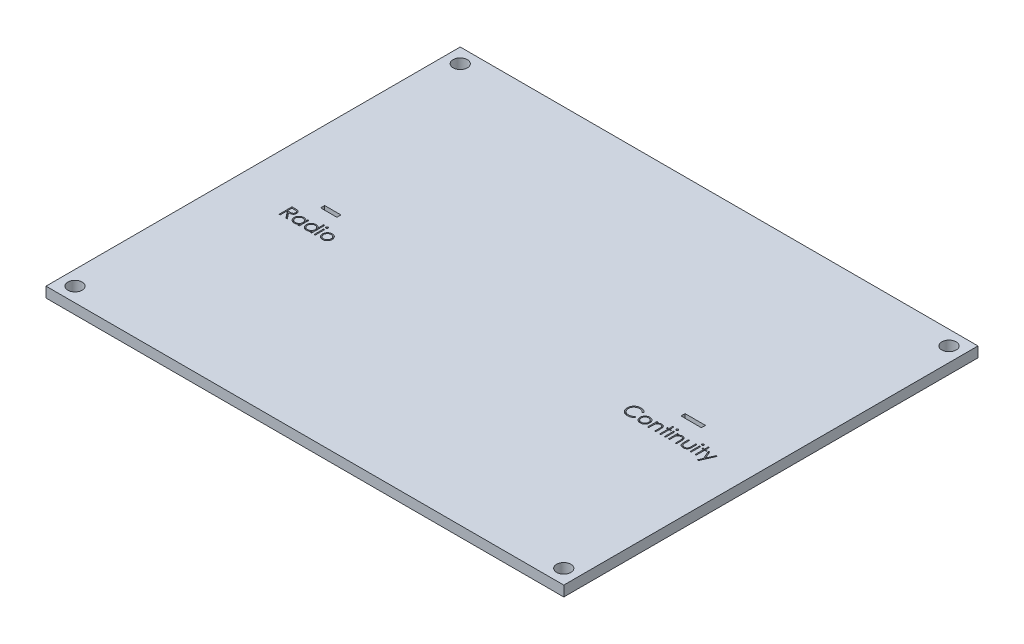
from build123d import *

# Parameters (mm, degrees)
IZIM1_W                     = 127
IZIM1_H                     = 101.6
Y_KSEKLIK_EKSTR_ZYON1_DEPTH = 2.54
IZIM3_W                     = 113.03
IZIM3_H                     = 87.63
Y_KSEKLIK_EKSTR_ZYON2_DEPTH = 1.27
IZIM4_R                     = 1.7526
KES_EKSTR_ZYON1_DEPTH       = 2.54
IZIM5_R                     = 1.7526
KES_EKSTR_ZYON2_DEPTH       = 2.54
IZIM7_R                     = 1.7526
KES_EKSTR_ZYON3_DEPTH       = 2.54
IZIM9_R                     = 1.7526
KES_EKSTR_ZYON4_DEPTH       = 2.54
IZIM10_W                    = 4
IZIM10_H                    = 1
KES_EKSTR_ZYON5_DEPTH       = 3.81
IZIM12_W                    = 0.284935898
IZIM12_H                    = 2.320192308
KES_EKSTR_ZYON9_DEPTH       = 0.762
IZIM13_W                    = 0.284935898
IZIM13_H                    = 2.320192308
IZIM13_W_2                  = 0.284935897
KES_EKSTR_ZYON10_DEPTH      = 0.762
IZIM11_W                    = 5
IZIM11_H                    = 1
KES_EKSTR_ZYON11_DEPTH      = 3.81


with BuildPart() as part:
    # Çizim1 → Yükseklik-Ekstrüzyon1 (new body)
    with BuildSketch(Plane(origin=(0, 0, 0), x_dir=(1, 0, 0), z_dir=(0, 1, 0))):
        Rectangle(IZIM1_W, IZIM1_H)
    extrude(amount=Y_KSEKLIK_EKSTR_ZYON1_DEPTH)

    # Çizim3 → Yükseklik-Ekstrüzyon2 (add)
    with BuildSketch(Plane.XZ):
        Rectangle(IZIM3_W, IZIM3_H)
    extrude(amount=Y_KSEKLIK_EKSTR_ZYON2_DEPTH)

    # Çizim4 → Kes-Ekstrüzyon1 (cut)
    with BuildSketch(Plane(origin=(0, 2.54, 0), x_dir=(1, 0, 0), z_dir=(0, 1, 0))):
        with Locations(Location((-59.944, 47.244, 0), (0, 0, 270))):
            Circle(IZIM4_R)
    extrude(amount=-KES_EKSTR_ZYON1_DEPTH, mode=Mode.SUBTRACT)

    # Çizim5 → Kes-Ekstrüzyon2 (cut)
    with BuildSketch(Plane(origin=(0, 2.54, 0), x_dir=(1, 0, 0), z_dir=(0, 1, 0))):
        with Locations(Location((59.944, 47.244, 0), (0, 0, 270))):
            Circle(IZIM5_R)
    extrude(amount=-KES_EKSTR_ZYON2_DEPTH, mode=Mode.SUBTRACT)

    # Çizim7 → Kes-Ekstrüzyon3 (cut)
    with BuildSketch(Plane(origin=(0, 2.54, 0), x_dir=(1, 0, 0), z_dir=(0, 1, 0))):
        with Locations(Location((-59.944, -47.244, 0), (0, 0, 270))):
            Circle(IZIM7_R)
    extrude(amount=-KES_EKSTR_ZYON3_DEPTH, mode=Mode.SUBTRACT)

    # Çizim9 → Kes-Ekstrüzyon4 (cut)
    with BuildSketch(Plane(origin=(0, 2.54, 0), x_dir=(1, 0, 0), z_dir=(0, 1, 0))):
        with Locations(Location((59.944, -47.244, 0), (0, 0, 270))):
            Circle(IZIM9_R)
    extrude(amount=-KES_EKSTR_ZYON4_DEPTH, mode=Mode.SUBTRACT)

    # Çizim10 → Kes-Ekstrüzyon5 (cut)
    with BuildSketch(Plane(origin=(0, 2.54, 0), x_dir=(1, 0, 0), z_dir=(0, 1, 0))):
        with Locations((-44.45, 0)):
            Rectangle(IZIM10_W, IZIM10_H)
    extrude(amount=-KES_EKSTR_ZYON5_DEPTH, mode=Mode.SUBTRACT)

    # Çizim12 → Kes-Ekstrüzyon9 (cut)
    # profile 1 of 6: a face of its own
    with BuildSketch(Plane(origin=(0, 2.54, 0), x_dir=(1, 0, 0), z_dir=(0, 1, 0))):
        with BuildLine():
            Line((-50.185607271, -3.776425051), (-49.55022566, -3.776425051))
            add(Edge.make_bspline(
                [(-49.55022566, -3.776425051), (-49.507824779, -3.776566189), (-49.426410391, -3.776837191), (-49.309776067, -3.778348276), (-49.203797201, -3.782679299), (-49.108529204, -3.786406371), (-49.023973824, -3.793202632), (-48.949871782, -3.799698362), (-48.88656437, -3.808201612), (-48.848241348, -3.816098674), (-48.830889723, -3.819674249)],
                knots=[0, 0, 0, 0, 1.410062039, 2.707475311, 3.878576406, 4.937260626, 5.877586885, 6.699081471, 7.410979367, 8, 8, 8, 8], degree=3))
            add(Edge.make_bspline(
                [(-48.830889723, -3.819674249), (-48.807660857, -3.825413529), (-48.761698659, -3.836769655), (-48.695522528, -3.860772293), (-48.632463105, -3.888548667), (-48.572782336, -3.921172899), (-48.516779154, -3.958887163), (-48.463876115, -4.001040388), (-48.413833159, -4.047401925), (-48.368674109, -4.099140674), (-48.326093683, -4.153420937), (-48.290181143, -4.212116487), (-48.259223551, -4.273495159), (-48.234576011, -4.338181173), (-48.214729563, -4.405547209), (-48.20073576, -4.476203475), (-48.192343612, -4.549828074), (-48.191489214, -4.600045605), (-48.191055989, -4.625508584)],
                knots=[0, 0, 0, 0, 1.027469482, 2.033020251, 3.019912614, 3.986113645, 4.951240523, 5.91722682, 6.890402269, 7.87763091, 8.8651537, 9.85103654, 10.82876324, 11.815024772, 12.821070561, 13.842952187, 14.906261191, 16, 16, 16, 16], degree=3))
            add(Edge.make_bspline(
                [(-48.191055989, -4.625508584), (-48.19238858, -4.667813286), (-48.19498881, -4.750360717), (-48.219232297, -4.870158803), (-48.258943854, -4.981909109), (-48.313665695, -5.085470931), (-48.383351934, -5.178825588), (-48.467103709, -5.260822644), (-48.564967742, -5.32943885), (-48.656071479, -5.377021037), (-48.736547931, -5.407494604), (-48.802799579, -5.428936158), (-48.875068909, -5.44550237), (-48.952663491, -5.460343346), (-49.035906236, -5.471548098), (-49.124597628, -5.479754651), (-49.218800923, -5.484883681), (-49.28351565, -5.4856475), (-49.316807191, -5.486040435)],
                knots=[0, 0, 0, 0, 1.260483769, 2.459530307, 3.627416485, 4.787058657, 5.939039949, 7.08810263, 8.267026773, 9.491475466, 10.141966685, 10.831826277, 11.566392101, 12.351337768, 13.187381173, 14.07005841, 15.007169909, 16, 16, 16, 16], degree=3))
            Line((-49.316807191, -5.486040435), (-48.150350861, -6.951425051))
            Line((-48.150350861, -6.951425051), (-48.502704627, -6.951425051))
            Line((-48.502704627, -6.951425051), (-49.669160957, -5.486040435))
            Line((-49.669160957, -5.486040435), (-49.900671373, -5.486040435))
            Line((-49.900671373, -5.486040435), (-49.900671373, -6.951425051))
            Line((-49.900671373, -6.951425051), (-50.185607271, -6.951425051))
            Line((-50.185607271, -6.951425051), (-50.185607271, -3.776425051))
        make_face()
        with BuildLine():
            Line((-49.900671373, -4.102066076), (-49.900671373, -5.16039941))
            Line((-49.900671373, -5.16039941), (-49.319351261, -5.164851533))
            add(Edge.make_bspline(
                [(-49.319351261, -5.164851533), (-49.292209512, -5.164863541), (-49.239601071, -5.164886815), (-49.163491182, -5.161263889), (-49.09262508, -5.15714245), (-49.027273827, -5.150838401), (-48.967408226, -5.142713965), (-48.913058201, -5.132551258), (-48.864135033, -5.120711172), (-48.807077073, -5.102385412), (-48.743362505, -5.073351381), (-48.674118967, -5.031109821), (-48.61515256, -4.977979263), (-48.565334214, -4.917224771), (-48.525302515, -4.850426174), (-48.497079437, -4.778384182), (-48.479170222, -4.702917518), (-48.477057898, -4.651048806), (-48.475991886, -4.624872567)],
                knots=[0, 0, 0, 0, 1.146690395, 2.22261258, 3.21895312, 4.145990853, 4.996080663, 5.770904154, 6.481378293, 7.121626537, 8.300444488, 9.431385265, 10.535395872, 11.636531494, 12.74115979, 13.810798291, 14.895190096, 16, 16, 16, 16], degree=3))
            add(Edge.make_bspline(
                [(-48.475991886, -4.624872567), (-48.477082382, -4.599339603), (-48.479243346, -4.548742587), (-48.496886158, -4.474669011), (-48.526721525, -4.404758278), (-48.566928126, -4.339294781), (-48.615913074, -4.27987172), (-48.673351376, -4.229028946), (-48.737672517, -4.187074074), (-48.797789961, -4.160264029), (-48.851523854, -4.143826734), (-48.898177903, -4.132259606), (-48.950893315, -4.12296641), (-49.009926052, -4.115520526), (-49.075024103, -4.109120684), (-49.146516622, -4.104810141), (-49.223929273, -4.102257565), (-49.277583989, -4.102131391), (-49.305358873, -4.102066076)],
                knots=[0, 0, 0, 0, 1.101028733, 2.181837193, 3.264309656, 4.369019818, 5.486613113, 6.575447106, 7.666700264, 8.788928104, 9.402425223, 10.0903467, 10.862060571, 11.710948788, 12.657782767, 13.684531032, 14.801375019, 16, 16, 16, 16], degree=3))
            Line((-49.305358873, -4.102066076), (-49.900671373, -4.102066076))
        make_face(mode=Mode.SUBTRACT)
    # profile 2 of 6: a face of its own
    with BuildSketch(Plane(origin=(0, 2.54, 0), x_dir=(1, 0, 0), z_dir=(0, 1, 0))):
        with BuildLine():
            Line((-45.21958163, -4.631232743), (-45.21958163, -6.951425051))
            Line((-45.21958163, -6.951425051), (-45.504517527, -6.951425051))
            Line((-45.504517527, -6.951425051), (-45.504517527, -6.550097927))
            add(Edge.make_bspline(
                [(-45.504517527, -6.550097927), (-45.53664743, -6.586419559), (-45.59934934, -6.65730168), (-45.704070925, -6.749904794), (-45.815076344, -6.826447985), (-45.931826828, -6.888269694), (-46.054216949, -6.934708203), (-46.181975399, -6.967715647), (-46.315154295, -6.988937198), (-46.406097502, -6.991056303), (-46.452183793, -6.992130179)],
                knots=[0, 0, 0, 0, 1.074387032, 2.096679803, 3.090159297, 4.057316773, 5.018401886, 5.985159533, 6.978961417, 8, 8, 8, 8], degree=3))
            add(Edge.make_bspline(
                [(-46.452183793, -6.992130179), (-46.49315758, -6.991017684), (-46.573959702, -6.988823795), (-46.692821793, -6.971803705), (-46.807205476, -6.944470927), (-46.917218839, -6.906460834), (-47.022149999, -6.856041089), (-47.122897373, -6.795678671), (-47.218939029, -6.723795918), (-47.308811068, -6.641619635), (-47.391571525, -6.552361326), (-47.464198537, -6.457160722), (-47.524753117, -6.35642949), (-47.575389904, -6.251442986), (-47.614393731, -6.141393023), (-47.641584099, -6.026660163), (-47.658584361, -5.907380064), (-47.660777344, -5.826154925), (-47.661889322, -5.784968721)],
                knots=[0, 0, 0, 0, 1.033919861, 2.038935746, 3.024066025, 3.998881131, 4.97069526, 5.957263378, 6.95902576, 7.993208707, 9.027059324, 10.027763471, 11.009749337, 11.988697705, 12.965288445, 13.950418724, 14.960734635, 16, 16, 16, 16], degree=3))
            add(Edge.make_bspline(
                [(-47.661889322, -5.784968721), (-47.660752698, -5.744633789), (-47.658505654, -5.664893807), (-47.641765947, -5.547619559), (-47.613616389, -5.434663708), (-47.57411227, -5.32638991), (-47.52345564, -5.22266715), (-47.461835161, -5.12342207), (-47.389246383, -5.02838126), (-47.305560271, -4.939779504), (-47.214905158, -4.857936518), (-47.117923667, -4.786808313), (-47.017028262, -4.725379457), (-46.910653959, -4.676708089), (-46.800375228, -4.63732983), (-46.685210317, -4.610085638), (-46.565638385, -4.594031639), (-46.484457724, -4.591706846), (-46.443279546, -4.590527615)],
                knots=[0, 0, 0, 0, 1.020392517, 2.01726096, 2.990465484, 3.961182959, 4.928053699, 5.906110375, 6.912531644, 7.948652711, 8.985773172, 9.998621852, 10.987621588, 11.969261332, 12.953316658, 13.946091881, 14.958173133, 16, 16, 16, 16], degree=3))
            add(Edge.make_bspline(
                [(-46.443279546, -4.590527615), (-46.395926817, -4.591831861), (-46.30307035, -4.594389426), (-46.167245656, -4.615673471), (-46.038753879, -4.651631224), (-45.916603146, -4.700542097), (-45.801232095, -4.76553773), (-45.693732959, -4.847525266), (-45.592980699, -4.945987628), (-45.534578577, -5.021616531), (-45.504517527, -5.060544642)],
                knots=[0, 0, 0, 0, 1.038897134, 2.037228247, 3.008116434, 3.962042015, 4.918381754, 5.904844433, 6.921570401, 8, 8, 8, 8], degree=3))
            Line((-45.504517527, -5.060544642), (-45.504517527, -4.631232743))
            Line((-45.504517527, -4.631232743), (-45.21958163, -4.631232743))
        make_face()
        with BuildLine():
            add(Edge.make_bspline(
                [(-46.439463441, -4.875463512), (-46.481114304, -4.876945455), (-46.563326484, -4.879870574), (-46.6840164, -4.902706531), (-46.799507855, -4.940701841), (-46.909223222, -4.992664709), (-47.01142939, -5.058005063), (-47.102772934, -5.137036603), (-47.184000956, -5.227603038), (-47.25231631, -5.329295666), (-47.308006261, -5.438314363), (-47.347164926, -5.552273675), (-47.3729906, -5.66911819), (-47.375629044, -5.748368627), (-47.376953425, -5.788148809)],
                knots=[0, 0, 0, 0, 1.031046209, 2.035121221, 3.029706178, 4.034933723, 5.034054252, 6.02443088, 7.017295772, 8.038157696, 9.050218397, 10.03989886, 11.016116709, 12, 12, 12, 12], degree=3))
            add(Edge.make_bspline(
                [(-47.376953425, -5.788148809), (-47.3752617, -5.827691263), (-47.371884882, -5.906621179), (-47.34761818, -6.023624988), (-47.306905724, -6.137611154), (-47.251350424, -6.247612199), (-47.1817847, -6.349742061), (-47.101149994, -6.442034886), (-47.008666524, -6.521400442), (-46.906225143, -6.587837383), (-46.796816484, -6.641506242), (-46.681759989, -6.678849357), (-46.563218517, -6.702959201), (-46.482616757, -6.705775405), (-46.442007511, -6.707194281)],
                knots=[0, 0, 0, 0, 0.979072187, 1.954306742, 2.945804271, 3.96968567, 4.997920485, 5.998718438, 6.996577872, 8.005894225, 9.015743152, 10.005417472, 10.995077863, 12, 12, 12, 12], degree=3))
            add(Edge.make_bspline(
                [(-46.442007511, -6.707194281), (-46.400781041, -6.705688457), (-46.31878568, -6.702693522), (-46.19773771, -6.679759802), (-46.080267279, -6.641869535), (-45.967974579, -6.589346756), (-45.863366374, -6.524252583), (-45.769479014, -6.448046151), (-45.690089528, -6.359415405), (-45.622786232, -6.262009623), (-45.570012819, -6.155228026), (-45.531571679, -6.04153201), (-45.508844208, -5.920917617), (-45.505979696, -5.838491055), (-45.504517527, -5.796417038)],
                knots=[0, 0, 0, 0, 1.01762866, 2.023962475, 3.030623092, 4.058876274, 5.077231937, 6.066672613, 7.034107872, 8.005628644, 8.981990164, 9.965428785, 10.961468474, 12, 12, 12, 12], degree=3))
            add(Edge.make_bspline(
                [(-45.504517527, -5.796417038), (-45.505388073, -5.764360577), (-45.507101582, -5.701263319), (-45.52019217, -5.60861907), (-45.541015567, -5.519960619), (-45.570358164, -5.435194751), (-45.608903829, -5.35479013), (-45.655392874, -5.278169433), (-45.710642818, -5.205731163), (-45.773764264, -5.138472806), (-45.842856983, -5.077125943), (-45.915967745, -5.022366954), (-45.993962751, -4.977382853), (-46.075530349, -4.940152556), (-46.160812059, -4.910526042), (-46.250501836, -4.890761491), (-46.343646346, -4.877190343), (-46.407188124, -4.876045183), (-46.439463441, -4.875463512)],
                knots=[0, 0, 0, 0, 1.050140795, 2.067009409, 3.05949893, 4.030605086, 5.00011959, 5.97591094, 6.962425594, 7.979863591, 8.993523472, 9.986985069, 10.967611495, 11.937549037, 12.921786183, 13.919465291, 14.943216303, 16, 16, 16, 16], degree=3))
        make_face(mode=Mode.SUBTRACT)
    # profile 3 of 6: a face of its own
    with BuildSketch(Plane(origin=(0, 2.54, 0), x_dir=(1, 0, 0), z_dir=(0, 1, 0))):
        with BuildLine():
            Line((-42.207402143, -3.695014794), (-42.207402143, -6.951425051))
            Line((-42.207402143, -6.951425051), (-42.49233804, -6.951425051))
            Line((-42.49233804, -6.951425051), (-42.49233804, -6.550097927))
            add(Edge.make_bspline(
                [(-42.49233804, -6.550097927), (-42.524467943, -6.586419559), (-42.587169853, -6.65730168), (-42.691891438, -6.749904794), (-42.802896857, -6.826447985), (-42.919647341, -6.888269694), (-43.042037462, -6.934708203), (-43.169795912, -6.967715647), (-43.302974808, -6.988937198), (-43.393918015, -6.991056303), (-43.440004306, -6.992130179)],
                knots=[0, 0, 0, 0, 1.074387032, 2.096679803, 3.090159297, 4.057316773, 5.018401886, 5.985159533, 6.978961417, 8, 8, 8, 8], degree=3))
            add(Edge.make_bspline(
                [(-43.440004306, -6.992130179), (-43.480978093, -6.991017684), (-43.561780214, -6.988823795), (-43.680642306, -6.971803705), (-43.795025989, -6.944470927), (-43.905039352, -6.906460834), (-44.009970512, -6.856041089), (-44.110717885, -6.795678671), (-44.206759542, -6.723795918), (-44.296631581, -6.641619635), (-44.379392038, -6.552361326), (-44.45201905, -6.457160722), (-44.512573629, -6.35642949), (-44.563210417, -6.251442986), (-44.602214244, -6.141393023), (-44.629404612, -6.026660163), (-44.646404874, -5.907380064), (-44.648597856, -5.826154925), (-44.649709835, -5.784968721)],
                knots=[0, 0, 0, 0, 1.033919861, 2.038935746, 3.024066025, 3.998881131, 4.97069526, 5.957263378, 6.95902576, 7.993208707, 9.027059324, 10.027763471, 11.009749337, 11.988697705, 12.965288445, 13.950418724, 14.960734635, 16, 16, 16, 16], degree=3))
            add(Edge.make_bspline(
                [(-44.649709835, -5.784968721), (-44.648573211, -5.744633789), (-44.646326166, -5.664893807), (-44.62958646, -5.547619559), (-44.601436902, -5.434663708), (-44.561932783, -5.32638991), (-44.511276153, -5.22266715), (-44.449655674, -5.12342207), (-44.377066896, -5.02838126), (-44.293380784, -4.939779504), (-44.202725671, -4.857936518), (-44.10574418, -4.786808313), (-44.004848774, -4.725379457), (-43.898474472, -4.676708089), (-43.788195741, -4.63732983), (-43.67303083, -4.610085638), (-43.553458898, -4.594031639), (-43.472278237, -4.591706846), (-43.431100059, -4.590527615)],
                knots=[0, 0, 0, 0, 1.020392517, 2.01726096, 2.990465484, 3.961182959, 4.928053699, 5.906110375, 6.912531644, 7.948652711, 8.985773172, 9.998621852, 10.987621588, 11.969261332, 12.953316658, 13.946091881, 14.958173133, 16, 16, 16, 16], degree=3))
            add(Edge.make_bspline(
                [(-43.431100059, -4.590527615), (-43.383731955, -4.591949195), (-43.290753631, -4.594739598), (-43.154774258, -4.618058946), (-43.02615264, -4.657213842), (-42.904148287, -4.710818076), (-42.78948855, -4.780487329), (-42.681332954, -4.864626142), (-42.581562369, -4.965615767), (-42.52253293, -5.041463409), (-42.49233804, -5.080261189)],
                knots=[0, 0, 0, 0, 1.031072012, 2.023879775, 2.993683497, 3.952812103, 4.918022106, 5.908088563, 6.929940113, 8, 8, 8, 8], degree=3))
            Line((-42.49233804, -5.080261189), (-42.49233804, -3.695014794))
            Line((-42.49233804, -3.695014794), (-42.207402143, -3.695014794))
        make_face()
        with BuildLine():
            add(Edge.make_bspline(
                [(-43.427283954, -4.875463512), (-43.468934817, -4.876945455), (-43.551146997, -4.879870574), (-43.671836913, -4.902706531), (-43.787328368, -4.940701841), (-43.897043735, -4.992664709), (-43.999249903, -5.058005063), (-44.090593447, -5.137036603), (-44.171821469, -5.227603038), (-44.240136823, -5.329295666), (-44.295826774, -5.438314363), (-44.334985438, -5.552273675), (-44.360811113, -5.66911819), (-44.363449557, -5.748368627), (-44.364773938, -5.788148809)],
                knots=[0, 0, 0, 0, 1.031046209, 2.035121221, 3.029706178, 4.034933723, 5.034054252, 6.02443088, 7.017295772, 8.038157696, 9.050218397, 10.03989886, 11.016116709, 12, 12, 12, 12], degree=3))
            add(Edge.make_bspline(
                [(-44.364773938, -5.788148809), (-44.363082213, -5.827691263), (-44.359705395, -5.906621179), (-44.335438693, -6.023624988), (-44.294726237, -6.137611154), (-44.239170937, -6.247612199), (-44.169605213, -6.349742061), (-44.088970507, -6.442034886), (-43.996487037, -6.521400442), (-43.894045656, -6.587837383), (-43.784636997, -6.641506242), (-43.669580502, -6.678849357), (-43.55103903, -6.702959201), (-43.47043727, -6.705775405), (-43.429828024, -6.707194281)],
                knots=[0, 0, 0, 0, 0.979072187, 1.954306742, 2.945804271, 3.96968567, 4.997920485, 5.998718438, 6.996577872, 8.005894225, 9.015743152, 10.005417472, 10.995077863, 12, 12, 12, 12], degree=3))
            add(Edge.make_bspline(
                [(-43.429828024, -6.707194281), (-43.388601554, -6.705688457), (-43.306606193, -6.702693522), (-43.185558222, -6.679759802), (-43.068087792, -6.641869535), (-42.955795092, -6.589346756), (-42.851186887, -6.524252583), (-42.757299527, -6.448046151), (-42.677910041, -6.359415405), (-42.610606745, -6.262009623), (-42.557833332, -6.155228026), (-42.519392192, -6.04153201), (-42.49666472, -5.920917617), (-42.493800209, -5.838491055), (-42.49233804, -5.796417038)],
                knots=[0, 0, 0, 0, 1.01762866, 2.023962475, 3.030623092, 4.058876274, 5.077231937, 6.066672613, 7.034107872, 8.005628644, 8.981990164, 9.965428785, 10.961468474, 12, 12, 12, 12], degree=3))
            add(Edge.make_bspline(
                [(-42.49233804, -5.796417038), (-42.493208586, -5.764360577), (-42.494922094, -5.701263319), (-42.508012682, -5.60861907), (-42.52883608, -5.519960619), (-42.558178677, -5.435194751), (-42.596724342, -5.35479013), (-42.643213387, -5.278169433), (-42.698463331, -5.205731163), (-42.761584776, -5.138472806), (-42.830677496, -5.077125943), (-42.903788258, -5.022366954), (-42.981783264, -4.977382853), (-43.063350862, -4.940152556), (-43.148632572, -4.910526042), (-43.238322349, -4.890761491), (-43.331466858, -4.877190343), (-43.395008637, -4.876045183), (-43.427283954, -4.875463512)],
                knots=[0, 0, 0, 0, 1.050140795, 2.067009409, 3.05949893, 4.030605086, 5.00011959, 5.97591094, 6.962425594, 7.979863591, 8.993523472, 9.986985069, 10.967611495, 11.937549037, 12.921786183, 13.919465291, 14.943216303, 16, 16, 16, 16], degree=3))
        make_face(mode=Mode.SUBTRACT)
    # profile 4 of 6: a face of its own
    with BuildSketch(Plane(origin=(0, 2.54, 0), x_dir=(1, 0, 0), z_dir=(0, 1, 0))):
        with BuildLine():
            add(Edge.make_bspline(
                [(-41.455629306, -3.654309666), (-41.437947898, -3.655129861), (-41.403324306, -3.656735962), (-41.353256127, -3.670489587), (-41.307665838, -3.693802873), (-41.267227466, -3.72508087), (-41.23252754, -3.761865008), (-41.20823361, -3.804737457), (-41.192619508, -3.851054937), (-41.190733961, -3.883362911), (-41.189773938, -3.899812471)],
                knots=[0, 0, 0, 0, 1.055194115, 2.066272739, 3.074728998, 4.095836921, 5.109056067, 6.073838105, 7.019297344, 8, 8, 8, 8], degree=3))
            add(Edge.make_bspline(
                [(-41.189773938, -3.899812471), (-41.190755611, -3.91583502), (-41.192696264, -3.947509705), (-41.208221549, -3.993024212), (-41.232734579, -4.035300954), (-41.267205215, -4.07201367), (-41.307671734, -4.103274375), (-41.353254561, -4.126592246), (-41.403324718, -4.140344656), (-41.437948037, -4.141950924), (-41.455629306, -4.142771205)],
                knots=[0, 0, 0, 0, 0.96129708, 1.900370562, 2.859976407, 3.87933698, 4.906634145, 5.921202961, 6.938410037, 8, 8, 8, 8], degree=3))
            add(Edge.make_bspline(
                [(-41.455629306, -4.142771205), (-41.473108384, -4.141982244), (-41.507129126, -4.140446636), (-41.556447619, -4.126322405), (-41.601649177, -4.103266396), (-41.642166416, -4.072218357), (-41.67593952, -4.035075486), (-41.700521572, -3.993050012), (-41.716011002, -3.947503136), (-41.717956486, -3.915832814), (-41.718940604, -3.899812471)],
                knots=[0, 0, 0, 0, 1.054934014, 2.053291228, 3.073705704, 4.106921865, 5.123545215, 6.088680038, 7.033164197, 8, 8, 8, 8], degree=3))
            add(Edge.make_bspline(
                [(-41.718940604, -3.899812471), (-41.717978047, -3.8833652), (-41.716087524, -3.851061722), (-41.700509962, -3.804711228), (-41.676144279, -3.762092295), (-41.642144053, -3.724876306), (-41.601655129, -3.693810804), (-41.556446081, -3.670759414), (-41.507129533, -3.656633985), (-41.473108522, -3.655098542), (-41.455629306, -3.654309666)],
                knots=[0, 0, 0, 0, 0.98631895, 1.937192651, 2.907499808, 3.917963147, 4.944918757, 5.95915025, 6.951458133, 8, 8, 8, 8], degree=3))
        make_face()
    # profile 5 of 6: a face of its own
    with BuildSketch(Plane(origin=(0, 2.54, 0), x_dir=(1, 0, 0), z_dir=(0, 1, 0))):
        with Locations((-41.454357271, -5.791328897)):
            Rectangle(IZIM12_W, IZIM12_H)
    # profile 6 of 6: a face of its own
    with BuildSketch(Plane(origin=(0, 2.54, 0), x_dir=(1, 0, 0), z_dir=(0, 1, 0))):
        with BuildLine():
            add(Edge.make_bspline(
                [(-39.499239082, -4.590527615), (-39.455704141, -4.591454616), (-39.370342763, -4.593272239), (-39.245331323, -4.612698672), (-39.126001093, -4.64240521), (-39.011895047, -4.683472984), (-38.904474551, -4.738520182), (-38.802174922, -4.804205753), (-38.705276635, -4.88202282), (-38.647198602, -4.942219068), (-38.617718649, -4.972774209)],
                knots=[0, 0, 0, 0, 1.054011418, 2.066658804, 3.057071809, 4.030435133, 4.997543892, 5.974964718, 6.972108034, 8, 8, 8, 8], degree=3))
            add(Edge.make_bspline(
                [(-38.617718649, -4.972774209), (-38.592335019, -5.001996896), (-38.542059003, -5.059876731), (-38.477592244, -5.153725752), (-38.422055543, -5.250917128), (-38.377548428, -5.352741489), (-38.342455585, -5.458309941), (-38.317540275, -5.567985337), (-38.302720341, -5.681525466), (-38.300721935, -5.75863609), (-38.299709835, -5.797689073)],
                knots=[0, 0, 0, 0, 1.025258237, 2.030674902, 3.01204498, 3.988269485, 4.97094183, 5.956517959, 6.965070386, 8, 8, 8, 8], degree=3))
            add(Edge.make_bspline(
                [(-38.299709835, -5.797689073), (-38.300600048, -5.836968411), (-38.302359151, -5.914586215), (-38.318999431, -6.028903783), (-38.344881202, -6.139751943), (-38.381921512, -6.246666615), (-38.429417797, -6.349974609), (-38.487375778, -6.4492247), (-38.556202174, -6.544612706), (-38.634220085, -6.63532866), (-38.720445716, -6.718936583), (-38.813986793, -6.791805799), (-38.913005095, -6.854236753), (-39.01881728, -6.904525502), (-39.130457071, -6.944176444), (-39.248165269, -6.972025745), (-39.371759011, -6.988863844), (-39.456147991, -6.991026085), (-39.499239082, -6.992130179)],
                knots=[0, 0, 0, 0, 0.998656419, 1.973391657, 2.932242238, 3.890759089, 4.846373663, 5.82037756, 6.809684879, 7.83454468, 8.860553229, 9.859544525, 10.845671541, 11.83227036, 12.833544569, 13.85385346, 14.904124723, 16, 16, 16, 16], degree=3))
            add(Edge.make_bspline(
                [(-39.499239082, -6.992130179), (-39.542541292, -6.991022379), (-39.627350857, -6.988852698), (-39.751380855, -6.972091163), (-39.869300009, -6.944189279), (-39.981085952, -6.904395196), (-40.087353064, -6.854235146), (-40.1869451, -6.791994542), (-40.280562166, -6.718914973), (-40.366806038, -6.635334515), (-40.444819058, -6.544611198), (-40.513646716, -6.449225091), (-40.571604369, -6.349974507), (-40.61910074, -6.246666642), (-40.656141027, -6.139751936), (-40.682022804, -6.028903784), (-40.698663083, -5.914586214), (-40.700422186, -5.836968411), (-40.701312399, -5.797689073)],
                knots=[0, 0, 0, 0, 1.099876186, 2.154163076, 3.173186993, 4.173200201, 5.163417411, 6.152872554, 7.150605724, 8.17532212, 9.198891216, 10.186952605, 11.159729845, 12.11414092, 13.071450619, 14.029093627, 15.002601286, 16, 16, 16, 16], degree=3))
            add(Edge.make_bspline(
                [(-40.701312399, -5.797689073), (-40.700293396, -5.758848349), (-40.698275945, -5.681950391), (-40.683470912, -5.568623701), (-40.658652793, -5.459133926), (-40.623517883, -5.353972959), (-40.578600532, -5.252594813), (-40.52384422, -5.155163288), (-40.458719861, -5.06173864), (-40.408643805, -5.003933611), (-40.383303585, -4.974682262)],
                knots=[0, 0, 0, 0, 1.031353054, 2.041901799, 3.029428768, 4.008703097, 4.981709435, 5.96992636, 6.972712378, 8, 8, 8, 8], degree=3))
            add(Edge.make_bspline(
                [(-40.383303585, -4.974682262), (-40.353868077, -4.943862139), (-40.295977972, -4.883248943), (-40.198597341, -4.805658725), (-40.096549374, -4.738606286), (-39.987941763, -4.684652862), (-39.873929456, -4.642163635), (-39.753987715, -4.612622061), (-39.628552068, -4.593342232), (-39.542772984, -4.591475171), (-39.499239082, -4.590527615)],
                knots=[0, 0, 0, 0, 1.027980169, 2.021703884, 2.998553061, 3.971491411, 4.943284454, 5.930300938, 6.949603206, 8, 8, 8, 8], degree=3))
        make_face()
        with BuildLine():
            add(Edge.make_bspline(
                [(-39.500511117, -4.875463512), (-39.531297379, -4.876338535), (-39.59207516, -4.878065991), (-39.681537212, -4.891204962), (-39.767661494, -4.912021626), (-39.850611403, -4.941598163), (-39.930107209, -4.979787878), (-40.006225024, -5.026694748), (-40.079188737, -5.081697501), (-40.147571038, -5.144710068), (-40.210329278, -5.213543156), (-40.265191443, -5.286884167), (-40.31184136, -5.363543495), (-40.350703505, -5.443600858), (-40.379647882, -5.527867548), (-40.400669124, -5.615389263), (-40.4137957, -5.70634432), (-40.415506914, -5.768176101), (-40.416376502, -5.799597126)],
                knots=[0, 0, 0, 0, 1.021534396, 2.016698045, 2.994645724, 3.958388632, 4.93408049, 5.916473867, 6.921342795, 7.962252576, 8.998418191, 10.008913653, 10.997312074, 11.973003931, 12.956656626, 13.948281152, 14.957379055, 16, 16, 16, 16], degree=3))
            add(Edge.make_bspline(
                [(-40.416376502, -5.799597126), (-40.414918883, -5.840193608), (-40.412025783, -5.920770033), (-40.388498818, -6.039434408), (-40.349141264, -6.153355088), (-40.295994232, -6.261864239), (-40.229404305, -6.362259805), (-40.15094818, -6.451768937), (-40.061467881, -6.529044638), (-39.962030056, -6.593162262), (-39.854665781, -6.644107183), (-39.741040404, -6.68021054), (-39.622530632, -6.703679861), (-39.541540254, -6.706012555), (-39.500511117, -6.707194281)],
                knots=[0, 0, 0, 0, 1.016792936, 2.018143844, 3.017858371, 4.030088057, 5.03801393, 6.028138512, 7.003788237, 7.991172063, 8.984598303, 9.972568034, 10.972917682, 12, 12, 12, 12], degree=3))
            add(Edge.make_bspline(
                [(-39.500511117, -6.707194281), (-39.459484339, -6.70600567), (-39.37849862, -6.703659384), (-39.26015351, -6.680328741), (-39.146838693, -6.643948991), (-39.039585934, -6.593219558), (-38.940193372, -6.528801153), (-38.850069526, -6.452205297), (-38.772283286, -6.362022732), (-38.70575923, -6.261731259), (-38.651741828, -6.153523311), (-38.612568495, -6.039413383), (-38.588984971, -5.920775388), (-38.586099505, -5.840195402), (-38.584645732, -5.799597126)],
                knots=[0, 0, 0, 0, 1.02726834, 2.027799167, 3.010890988, 4.004497153, 4.992059811, 5.971914811, 6.958719428, 7.966827853, 8.981595046, 9.981490638, 10.983022906, 12, 12, 12, 12], degree=3))
            add(Edge.make_bspline(
                [(-38.584645732, -5.799597126), (-38.58551502, -5.768175913), (-38.587225646, -5.706343763), (-38.600356506, -5.615391394), (-38.621361889, -5.527859731), (-38.650364713, -5.4436297), (-38.689057997, -5.363336214), (-38.736607517, -5.287109247), (-38.791245661, -5.213289094), (-38.854761192, -5.144932577), (-38.923072113, -5.081672937), (-38.996065398, -5.02667342), (-39.072070343, -4.979994029), (-39.1513352, -4.941271511), (-39.234295744, -4.91229071), (-39.320299354, -4.891084765), (-39.409379703, -4.878121516), (-39.469939692, -4.87635518), (-39.500511117, -4.875463512)],
                knots=[0, 0, 0, 0, 1.042956736, 2.052379634, 3.044323526, 4.02829302, 5.004299113, 5.996692471, 7.007513377, 8.048758398, 9.090003419, 10.095195979, 11.07790575, 12.047570684, 13.018257071, 13.989683339, 14.985167495, 16, 16, 16, 16], degree=3))
        make_face(mode=Mode.SUBTRACT)
    extrude(amount=-KES_EKSTR_ZYON9_DEPTH, mode=Mode.SUBTRACT)

    # Çizim13 → Kes-Ekstrüzyon10 (cut)
    # profile 1 of 12: a face of its own
    with BuildSketch(Plane(origin=(0, 2.54, 0), x_dir=(1, 0, 0), z_dir=(0, 1, 0))):
        with BuildLine():
            Line((36.723364142, -4.359017198), (36.474045232, -4.549822487))
            add(Edge.make_bspline(
                [(36.474045232, -4.549822487), (36.45625989, -4.528626214), (36.420928992, -4.48651944), (36.364088144, -4.427392282), (36.304850225, -4.371997367), (36.243237879, -4.320070804), (36.178142107, -4.273428452), (36.111139811, -4.229639666), (36.041110155, -4.190389647), (35.944271082, -4.142798224), (35.817590534, -4.09313564), (35.658119501, -4.051494852), (35.491648719, -4.024987071), (35.378076611, -4.022116108), (35.320309254, -4.02065582)],
                knots=[0, 0, 0, 0, 0.757959112, 1.505699292, 2.245454638, 2.979532153, 3.711538275, 4.438200793, 5.171680507, 5.909471876, 7.393775596, 8.890124382, 10.418191784, 12, 12, 12, 12], degree=3))
            add(Edge.make_bspline(
                [(35.320309254, -4.02065582), (35.28848369, -4.021022272), (35.225127932, -4.021751774), (35.13110396, -4.031375766), (35.038835692, -4.044902364), (34.948383148, -4.064973193), (34.859861464, -4.090348354), (34.772691928, -4.12066998), (34.688136598, -4.158184727), (34.605025768, -4.199648649), (34.525397483, -4.246482117), (34.45005469, -4.297566372), (34.379272176, -4.352329766), (34.312993949, -4.410977556), (34.251152253, -4.47324562), (34.194195193, -4.539797558), (34.142319856, -4.610420601), (34.094497984, -4.684183478), (34.05166929, -4.760871332), (34.015810042, -4.840768003), (33.984055396, -4.922505297), (33.958928225, -5.007006707), (33.939039557, -5.093677644), (33.925316605, -5.182750716), (33.915802063, -5.27403984), (33.915076188, -5.335915431), (33.914710296, -5.367105139)],
                knots=[0, 0, 0, 0, 1.054917814, 2.100044995, 3.131103042, 4.146048494, 5.169673617, 6.183595914, 7.203665975, 8.234915748, 9.262203917, 10.264457458, 11.251630812, 12.227803204, 13.197192746, 14.159520551, 15.12972552, 16.100847026, 17.073214652, 18.039054194, 19.002613845, 19.979014051, 20.95965708, 21.949030935, 22.966165397, 24, 24, 24, 24], degree=3))
            add(Edge.make_bspline(
                [(33.914710296, -5.367105139), (33.915854946, -5.414032836), (33.918102315, -5.506169145), (33.938103303, -5.641125342), (33.968497208, -5.770411953), (34.01404991, -5.89322081), (34.070219334, -6.011066249), (34.141194746, -6.121954352), (34.22339689, -6.227560807), (34.317988685, -6.325389767), (34.421771104, -6.414755789), (34.533120995, -6.493450959), (34.651761028, -6.559050888), (34.776381257, -6.613639068), (34.90794066, -6.655600529), (35.046202659, -6.685140841), (35.190866541, -6.704410533), (35.289717353, -6.706255379), (35.340025801, -6.707194281)],
                knots=[0, 0, 0, 0, 1.029171465, 2.020641659, 2.987623507, 3.938342917, 4.889210282, 5.84687017, 6.821220943, 7.821438502, 8.827599549, 9.822697543, 10.807740252, 11.797342354, 12.80366471, 13.83203677, 14.896651826, 16, 16, 16, 16], degree=3))
            add(Edge.make_bspline(
                [(35.340025801, -6.707194281), (35.395454669, -6.705662317), (35.50455194, -6.702647044), (35.664542936, -6.677102583), (35.817701094, -6.635684329), (35.964034655, -6.577719785), (36.103131084, -6.502367702), (36.235208054, -6.411020342), (36.360377051, -6.302808783), (36.435643857, -6.220183374), (36.474045232, -6.178027615)],
                knots=[0, 0, 0, 0, 1.028121516, 2.023589091, 2.998037872, 3.967518031, 4.937445131, 5.927275754, 6.942489185, 8, 8, 8, 8], degree=3))
            Line((36.474045232, -6.178027615), (36.723364142, -6.36692485))
            add(Edge.make_bspline(
                [(36.723364142, -6.36692485), (36.703299857, -6.392813303), (36.663267393, -6.444466205), (36.598444763, -6.517284113), (36.5301575, -6.585777059), (36.457898392, -6.64939283), (36.382498681, -6.709404381), (36.302604512, -6.764106756), (36.219266175, -6.814263487), (36.132766041, -6.86018934), (36.043196014, -6.9009357), (35.950663419, -6.935818761), (35.855567111, -6.965867768), (35.757902743, -6.990589167), (35.657467735, -7.009885079), (35.554624519, -7.022784356), (35.449151132, -7.031621664), (35.377993557, -7.03242713), (35.341933854, -7.032835307)],
                knots=[0, 0, 0, 0, 0.986787822, 1.968848986, 2.935600012, 3.899624008, 4.868462664, 5.837806735, 6.815139263, 7.798259679, 8.787526145, 9.778297419, 10.776456485, 11.791383307, 12.812564526, 13.85620153, 14.913611965, 16, 16, 16, 16], degree=3))
            add(Edge.make_bspline(
                [(35.341933854, -7.032835307), (35.30778567, -7.032597642), (35.240261865, -7.03212769), (35.140567998, -7.024514795), (35.043513164, -7.014128248), (34.949374753, -6.998488986), (34.857639047, -6.980033764), (34.76913766, -6.955294838), (34.682999719, -6.92758238), (34.599571296, -6.895011428), (34.518781425, -6.858257462), (34.440890682, -6.816717976), (34.36593489, -6.770742285), (34.293177115, -6.721343811), (34.223692164, -6.66693583), (34.156877895, -6.608273955), (34.092359648, -6.545555902), (34.052442927, -6.500330428), (34.032373557, -6.477591918)],
                knots=[0, 0, 0, 0, 1.114604814, 2.203992996, 3.262667896, 4.300477797, 5.318619304, 6.316056647, 7.298880507, 8.271930387, 9.238335007, 10.195173496, 11.151986948, 12.108099108, 13.064862484, 14.031167946, 15.010108607, 16, 16, 16, 16], degree=3))
            add(Edge.make_bspline(
                [(34.032373557, -6.477591918), (34.000228366, -6.438093839), (33.936326069, -6.359574538), (33.854569199, -6.232315112), (33.784585346, -6.099447522), (33.728001475, -5.96027373), (33.68376671, -5.815106028), (33.65312234, -5.66387124), (33.633209099, -5.506710607), (33.630931908, -5.399815806), (33.629774398, -5.345480539)],
                knots=[0, 0, 0, 0, 0.994628077, 1.977248131, 2.950237994, 3.925870899, 4.908910175, 5.911660606, 6.938484602, 8, 8, 8, 8], degree=3))
            add(Edge.make_bspline(
                [(33.629774398, -5.345480539), (33.631185181, -5.288370949), (33.633960808, -5.176011396), (33.657542708, -5.011116453), (33.695478331, -4.853136256), (33.749359794, -4.702365716), (33.817672505, -4.558011819), (33.902060934, -4.421177297), (34.001544698, -4.290987058), (34.115343563, -4.169416533), (34.240136789, -4.058255835), (34.373775999, -3.960460207), (34.515999622, -3.879073603), (34.665240816, -3.81104137), (34.822617113, -3.758749607), (34.98779274, -3.722143502), (35.160457327, -3.69935869), (35.278261099, -3.696478322), (35.338117748, -3.695014794)],
                knots=[0, 0, 0, 0, 1.032925535, 2.032216505, 3.007276963, 3.968222605, 4.92396291, 5.891752235, 6.871517503, 7.883894988, 8.900124299, 9.891468569, 10.874487609, 11.85992873, 12.854644235, 13.869047385, 14.917252991, 16, 16, 16, 16], degree=3))
            add(Edge.make_bspline(
                [(35.338117748, -3.695014794), (35.374598019, -3.695452163), (35.446807041, -3.696317889), (35.553625519, -3.704759889), (35.657622487, -3.718832946), (35.758869592, -3.737988238), (35.857859394, -3.761762023), (35.953835327, -3.79273215), (36.047360564, -3.828143861), (36.137845259, -3.868927612), (36.224855273, -3.914708156), (36.308363504, -3.964978043), (36.387706626, -4.019674953), (36.463442939, -4.07833369), (36.534305502, -4.14219524), (36.602306271, -4.20950306), (36.665135964, -4.282195886), (36.703919219, -4.333363219), (36.723364142, -4.359017198)],
                knots=[0, 0, 0, 0, 1.096760587, 2.17092713, 3.219439832, 4.250915756, 5.268269357, 6.278326846, 7.281116186, 8.274029601, 9.260640565, 10.235837813, 11.203064059, 12.156899882, 13.114053108, 14.069676657, 15.032185724, 16, 16, 16, 16], degree=3))
        make_face()
    # profile 2 of 12: a face of its own
    with BuildSketch(Plane(origin=(0, 2.54, 0), x_dir=(1, 0, 0), z_dir=(0, 1, 0))):
        with BuildLine():
            add(Edge.make_bspline(
                [(38.413898998, -4.590527615), (38.457433938, -4.591454616), (38.542795317, -4.593272239), (38.667806756, -4.612698672), (38.787136987, -4.64240521), (38.901243032, -4.683472984), (39.008663529, -4.738520182), (39.110963157, -4.804205753), (39.207861444, -4.88202282), (39.265939478, -4.942219068), (39.29541943, -4.972774209)],
                knots=[0, 0, 0, 0, 1.054011418, 2.066658804, 3.057071809, 4.030435133, 4.997543892, 5.974964718, 6.972108034, 8, 8, 8, 8], degree=3))
            add(Edge.make_bspline(
                [(39.29541943, -4.972774209), (39.32080306, -5.001996896), (39.371079077, -5.059876731), (39.435545836, -5.153725752), (39.491082537, -5.250917128), (39.535589651, -5.352741489), (39.570682494, -5.458309941), (39.595597804, -5.567985337), (39.610417738, -5.681525466), (39.612416144, -5.75863609), (39.613428245, -5.797689073)],
                knots=[0, 0, 0, 0, 1.025258237, 2.030674902, 3.01204498, 3.988269485, 4.97094183, 5.956517959, 6.965070386, 8, 8, 8, 8], degree=3))
            add(Edge.make_bspline(
                [(39.613428245, -5.797689073), (39.612538031, -5.836968411), (39.610778929, -5.914586215), (39.594138648, -6.028903783), (39.568256877, -6.139751943), (39.531216567, -6.246666615), (39.483720282, -6.349974609), (39.425762301, -6.4492247), (39.356935906, -6.544612706), (39.278917994, -6.63532866), (39.192692364, -6.718936583), (39.099151287, -6.791805799), (39.000132985, -6.854236753), (38.8943208, -6.904525502), (38.782681008, -6.944176444), (38.664972811, -6.972025745), (38.541379068, -6.988863844), (38.456990089, -6.991026085), (38.413898998, -6.992130179)],
                knots=[0, 0, 0, 0, 0.998656419, 1.973391657, 2.932242238, 3.890759089, 4.846373663, 5.82037756, 6.809684879, 7.83454468, 8.860553229, 9.859544525, 10.845671541, 11.83227036, 12.833544569, 13.85385346, 14.904124723, 16, 16, 16, 16], degree=3))
            add(Edge.make_bspline(
                [(38.413898998, -6.992130179), (38.370596788, -6.991022379), (38.285787222, -6.988852698), (38.161757224, -6.972091163), (38.04383807, -6.944189279), (37.932052127, -6.904395196), (37.825785016, -6.854235146), (37.726192979, -6.791994542), (37.632575913, -6.718914973), (37.546332042, -6.635334515), (37.468319021, -6.544611198), (37.399491364, -6.449225091), (37.341533711, -6.349974507), (37.29403734, -6.246666642), (37.256997052, -6.139751936), (37.231115276, -6.028903784), (37.214474997, -5.914586214), (37.212715894, -5.836968411), (37.21182568, -5.797689073)],
                knots=[0, 0, 0, 0, 1.099876186, 2.154163076, 3.173186993, 4.173200201, 5.163417411, 6.152872554, 7.150605724, 8.17532212, 9.198891216, 10.186952605, 11.159729845, 12.11414092, 13.071450619, 14.029093627, 15.002601286, 16, 16, 16, 16], degree=3))
            add(Edge.make_bspline(
                [(37.21182568, -5.797689073), (37.212844683, -5.758848349), (37.214862134, -5.681950391), (37.229667167, -5.568623701), (37.254485286, -5.459133926), (37.289620196, -5.353972959), (37.334537548, -5.252594813), (37.389293859, -5.155163288), (37.454418219, -5.06173864), (37.504494275, -5.003933611), (37.529834495, -4.974682262)],
                knots=[0, 0, 0, 0, 1.031353054, 2.041901799, 3.029428768, 4.008703097, 4.981709435, 5.96992636, 6.972712378, 8, 8, 8, 8], degree=3))
            add(Edge.make_bspline(
                [(37.529834495, -4.974682262), (37.559270002, -4.943862139), (37.617160107, -4.883248943), (37.714540739, -4.805658725), (37.816588705, -4.738606286), (37.925196317, -4.684652862), (38.039208624, -4.642163635), (38.159150365, -4.612622061), (38.284586011, -4.593342232), (38.370365096, -4.591475171), (38.413898998, -4.590527615)],
                knots=[0, 0, 0, 0, 1.027980169, 2.021703884, 2.998553061, 3.971491411, 4.943284454, 5.930300938, 6.949603206, 8, 8, 8, 8], degree=3))
        make_face()
        with BuildLine():
            add(Edge.make_bspline(
                [(38.412626963, -4.875463512), (38.381840701, -4.876338535), (38.32106292, -4.878065991), (38.231600868, -4.891204962), (38.145476585, -4.912021626), (38.062526677, -4.941598163), (37.98303087, -4.979787878), (37.906913055, -5.026694748), (37.833949342, -5.081697501), (37.765567042, -5.144710068), (37.702808801, -5.213543156), (37.647946637, -5.286884167), (37.601296719, -5.363543495), (37.562434575, -5.443600858), (37.533490197, -5.527867548), (37.512468955, -5.615389263), (37.49934238, -5.70634432), (37.497631165, -5.768176101), (37.496761578, -5.799597126)],
                knots=[0, 0, 0, 0, 1.021534396, 2.016698045, 2.994645724, 3.958388632, 4.93408049, 5.916473867, 6.921342795, 7.962252576, 8.998418191, 10.008913653, 10.997312074, 11.973003931, 12.956656626, 13.948281152, 14.957379055, 16, 16, 16, 16], degree=3))
            add(Edge.make_bspline(
                [(37.496761578, -5.799597126), (37.498219196, -5.840193608), (37.501112297, -5.920770033), (37.524639261, -6.039434408), (37.563996815, -6.153355088), (37.617143847, -6.261864239), (37.683733774, -6.362259805), (37.762189899, -6.451768937), (37.851670199, -6.529044638), (37.951108024, -6.593162262), (38.058472298, -6.644107183), (38.172097675, -6.68021054), (38.290607448, -6.703679861), (38.371597825, -6.706012555), (38.412626963, -6.707194281)],
                knots=[0, 0, 0, 0, 1.016792936, 2.018143844, 3.017858371, 4.030088057, 5.03801393, 6.028138512, 7.003788237, 7.991172063, 8.984598303, 9.972568034, 10.972917682, 12, 12, 12, 12], degree=3))
            add(Edge.make_bspline(
                [(38.412626963, -6.707194281), (38.45365374, -6.70600567), (38.534639459, -6.703659384), (38.65298457, -6.680328741), (38.766299387, -6.643948991), (38.873552146, -6.593219558), (38.972944707, -6.528801153), (39.063068553, -6.452205297), (39.140854793, -6.362022732), (39.207378849, -6.261731259), (39.261396251, -6.153523311), (39.300569584, -6.039413383), (39.324153109, -5.920775388), (39.327038575, -5.840195402), (39.328492347, -5.799597126)],
                knots=[0, 0, 0, 0, 1.02726834, 2.027799167, 3.010890988, 4.004497153, 4.992059811, 5.971914811, 6.958719428, 7.966827853, 8.981595046, 9.981490638, 10.983022906, 12, 12, 12, 12], degree=3))
            add(Edge.make_bspline(
                [(39.328492347, -5.799597126), (39.327623059, -5.768175913), (39.325912434, -5.706343763), (39.312781573, -5.615391394), (39.291776191, -5.527859731), (39.262773366, -5.4436297), (39.224080082, -5.363336214), (39.176530563, -5.287109247), (39.121892419, -5.213289094), (39.058376887, -5.144932577), (38.990065966, -5.081672937), (38.917072681, -5.02667342), (38.841067737, -4.979994029), (38.761802879, -4.941271511), (38.678842336, -4.91229071), (38.592838726, -4.891084765), (38.503758377, -4.878121516), (38.443198388, -4.87635518), (38.412626963, -4.875463512)],
                knots=[0, 0, 0, 0, 1.042956736, 2.052379634, 3.044323526, 4.02829302, 5.004299113, 5.996692471, 7.007513377, 8.048758398, 9.090003419, 10.095195979, 11.07790575, 12.047570684, 13.018257071, 13.989683339, 14.985167495, 16, 16, 16, 16], degree=3))
        make_face(mode=Mode.SUBTRACT)
    # profile 3 of 12: a face of its own
    with BuildSketch(Plane(origin=(0, 2.54, 0), x_dir=(1, 0, 0), z_dir=(0, 1, 0))):
        with BuildLine():
            Line((40.183300039, -4.631232743), (40.468235937, -4.631232743))
            Line((40.468235937, -4.631232743), (40.468235937, -5.049732342))
            add(Edge.make_bspline(
                [(40.468235937, -5.049732342), (40.498659363, -5.011775015), (40.557697083, -4.938117498), (40.656017157, -4.841306691), (40.759924838, -4.761527808), (40.868783798, -4.697933652), (40.982741814, -4.649994213), (41.101104245, -4.615372261), (41.224579728, -4.594612452), (41.308548896, -4.591899886), (41.351028405, -4.590527615)],
                knots=[0, 0, 0, 0, 1.12780773, 2.188550248, 3.19190651, 4.159438251, 5.104880172, 6.052711206, 7.014878035, 8, 8, 8, 8], degree=3))
            add(Edge.make_bspline(
                [(41.351028405, -4.590527615), (41.393964051, -4.592110756), (41.477999469, -4.595209346), (41.600353139, -4.619717345), (41.714629003, -4.661577683), (41.8204196, -4.718920061), (41.915785001, -4.790227362), (41.99953683, -4.873301493), (42.068809205, -4.968856368), (42.115252527, -5.057505232), (42.145846507, -5.136144352), (42.16510727, -5.203496761), (42.181463947, -5.278533941), (42.195644175, -5.36102914), (42.205239127, -5.451560355), (42.212806777, -5.549756476), (42.218230307, -5.655585694), (42.218445487, -5.728779992), (42.21855645, -5.766524209)],
                knots=[0, 0, 0, 0, 1.235846778, 2.418850247, 3.575807741, 4.728682307, 5.871620074, 6.994088408, 8.11269785, 9.256955736, 9.865816715, 10.540099792, 11.271859618, 12.076849838, 12.949306005, 13.892391288, 14.913166135, 16, 16, 16, 16], degree=3))
            Line((42.21855645, -5.766524209), (42.21855645, -6.951425051))
            Line((42.21855645, -6.951425051), (41.933620552, -6.951425051))
            Line((41.933620552, -6.951425051), (41.933620552, -5.860018801))
            add(Edge.make_bspline(
                [(41.933620552, -5.860018801), (41.933445285, -5.828429869), (41.933110029, -5.768005617), (41.93205262, -5.681492289), (41.929503724, -5.603036607), (41.925922041, -5.532826138), (41.920679634, -5.470928301), (41.915216247, -5.417217028), (41.908535161, -5.371760515), (41.902581661, -5.344396476), (41.899911618, -5.332124169)],
                knots=[0, 0, 0, 0, 1.430800155, 2.736877192, 3.918605307, 4.986035426, 5.920637409, 6.731861385, 7.431261377, 8, 8, 8, 8], degree=3))
            add(Edge.make_bspline(
                [(41.899911618, -5.332124169), (41.890272743, -5.296100452), (41.871720891, -5.22676594), (41.825879349, -5.132718492), (41.767990771, -5.052710136), (41.697326293, -4.987235538), (41.614568489, -4.936280565), (41.519947009, -4.90092562), (41.414374957, -4.878812862), (41.340121338, -4.876611106), (41.30141903, -4.875463512)],
                knots=[0, 0, 0, 0, 1.084156227, 2.086665306, 3.027808233, 3.945421172, 4.874247719, 5.839848303, 6.874090471, 8, 8, 8, 8], degree=3))
            add(Edge.make_bspline(
                [(41.30141903, -4.875463512), (41.278497631, -4.875895316), (41.233136775, -4.876749846), (41.165872158, -4.885323523), (41.100626658, -4.899346551), (41.036745468, -4.918277386), (40.975506256, -4.944278159), (40.914941506, -4.973786945), (40.857331798, -5.010569966), (40.801448717, -5.051564315), (40.749457812, -5.09699331), (40.701081391, -5.14493083), (40.657957616, -5.195980842), (40.618888175, -5.249320795), (40.585162178, -5.305683248), (40.555722591, -5.36452444), (40.530743783, -5.425921818), (40.518331626, -5.468534909), (40.512121153, -5.489856541)],
                knots=[0, 0, 0, 0, 1.023777757, 2.026029729, 3.023749952, 4.003683103, 4.997618607, 5.993177895, 7.010360494, 8.046726602, 9.087585522, 10.09234134, 11.086953743, 12.070360549, 13.043493632, 14.017870808, 15.008233677, 16, 16, 16, 16], degree=3))
            add(Edge.make_bspline(
                [(40.512121153, -5.489856541), (40.508547329, -5.505509475), (40.500767301, -5.539585094), (40.492364274, -5.595505389), (40.484737402, -5.660193723), (40.478353875, -5.733574611), (40.474448247, -5.815904969), (40.470189759, -5.906833193), (40.468639396, -6.006721858), (40.468374189, -6.076264965), (40.468235937, -6.112517799)],
                knots=[0, 0, 0, 0, 0.615963638, 1.340920617, 2.168419149, 3.115676021, 4.16674242, 5.331190069, 6.6087489, 8, 8, 8, 8], degree=3))
            Line((40.468235937, -6.112517799), (40.468235937, -6.951425051))
            Line((40.468235937, -6.951425051), (40.183300039, -6.951425051))
            Line((40.183300039, -6.951425051), (40.183300039, -4.631232743))
        make_face()
    # profile 4 of 12: a face of its own
    with BuildSketch(Plane(origin=(0, 2.54, 0), x_dir=(1, 0, 0), z_dir=(0, 1, 0))):
        Polygon((43.154774398, -3.695014794), (43.439710296, -3.695014794), (43.439710296, -4.631232743), (43.846761578, -4.631232743), (43.846761578, -4.91616864), (43.439710296, -4.91616864), (43.439710296, -6.951425051), (43.154774398, -6.951425051), (43.154774398, -4.91616864), (42.747723116, -4.91616864), (42.747723116, -4.631232743), (43.154774398, -4.631232743), align=None)
    # profile 5 of 12: a face of its own
    with BuildSketch(Plane(origin=(0, 2.54, 0), x_dir=(1, 0, 0), z_dir=(0, 1, 0))):
        with BuildLine():
            add(Edge.make_bspline(
                [(44.435713902, -3.654309666), (44.45339531, -3.655129861), (44.488018902, -3.656735962), (44.538087081, -3.670489587), (44.58367737, -3.693802873), (44.624115742, -3.72508087), (44.658815668, -3.761865008), (44.683109598, -3.804737457), (44.6987237, -3.851054937), (44.700609247, -3.883362911), (44.70156927, -3.899812471)],
                knots=[0, 0, 0, 0, 1.055194115, 2.066272739, 3.074728998, 4.095836921, 5.109056067, 6.073838105, 7.019297344, 8, 8, 8, 8], degree=3))
            add(Edge.make_bspline(
                [(44.70156927, -3.899812471), (44.700587597, -3.91583502), (44.698646944, -3.947509705), (44.683121658, -3.993024212), (44.658608628, -4.035300954), (44.624137993, -4.07201367), (44.583671474, -4.103274375), (44.538088647, -4.126592246), (44.48801849, -4.140344656), (44.45339517, -4.141950924), (44.435713902, -4.142771205)],
                knots=[0, 0, 0, 0, 0.96129708, 1.900370562, 2.859976407, 3.87933698, 4.906634145, 5.921202961, 6.938410037, 8, 8, 8, 8], degree=3))
            add(Edge.make_bspline(
                [(44.435713902, -4.142771205), (44.418234823, -4.141982244), (44.384214081, -4.140446636), (44.334895589, -4.126322405), (44.28969403, -4.103266396), (44.249176792, -4.072218357), (44.215403688, -4.035075486), (44.190821636, -3.993050012), (44.175332206, -3.947503136), (44.173386721, -3.915832814), (44.172402604, -3.899812471)],
                knots=[0, 0, 0, 0, 1.054934014, 2.053291228, 3.073705704, 4.106921865, 5.123545215, 6.088680038, 7.033164197, 8, 8, 8, 8], degree=3))
            add(Edge.make_bspline(
                [(44.172402604, -3.899812471), (44.173365161, -3.8833652), (44.175255684, -3.851061722), (44.190833246, -3.804711228), (44.215198929, -3.762092295), (44.249199154, -3.724876306), (44.289688079, -3.693810804), (44.334897126, -3.670759414), (44.384213675, -3.656633985), (44.418234686, -3.655098542), (44.435713902, -3.654309666)],
                knots=[0, 0, 0, 0, 0.98631895, 1.937192651, 2.907499808, 3.917963147, 4.944918757, 5.95915025, 6.951458133, 8, 8, 8, 8], degree=3))
        make_face()
    # profile 6 of 12: a face of its own
    with BuildSketch(Plane(origin=(0, 2.54, 0), x_dir=(1, 0, 0), z_dir=(0, 1, 0))):
        with Locations((44.436985937, -5.791328897)):
            Rectangle(IZIM13_W, IZIM13_H)
    # profile 7 of 12: a face of its own
    with BuildSketch(Plane(origin=(0, 2.54, 0), x_dir=(1, 0, 0), z_dir=(0, 1, 0))):
        with BuildLine():
            Line((45.271441065, -4.631232743), (45.556376963, -4.631232743))
            Line((45.556376963, -4.631232743), (45.556376963, -5.049732342))
            add(Edge.make_bspline(
                [(45.556376963, -5.049732342), (45.586800389, -5.011775015), (45.645838109, -4.938117498), (45.744158182, -4.841306691), (45.848065863, -4.761527808), (45.956924824, -4.697933652), (46.07088284, -4.649994213), (46.189245271, -4.615372261), (46.312720754, -4.594612452), (46.396689922, -4.591899886), (46.43916943, -4.590527615)],
                knots=[0, 0, 0, 0, 1.12780773, 2.188550248, 3.19190651, 4.159438251, 5.104880172, 6.052711206, 7.014878035, 8, 8, 8, 8], degree=3))
            add(Edge.make_bspline(
                [(46.43916943, -4.590527615), (46.482105077, -4.592110756), (46.566140494, -4.595209346), (46.688494164, -4.619717345), (46.802770029, -4.661577683), (46.908560626, -4.718920061), (47.003926026, -4.790227362), (47.087677856, -4.873301493), (47.15695023, -4.968856368), (47.203393552, -5.057505232), (47.233987533, -5.136144352), (47.253248296, -5.203496761), (47.269604972, -5.278533941), (47.283785201, -5.36102914), (47.293380152, -5.451560355), (47.300947802, -5.549756476), (47.306371332, -5.655585694), (47.306586513, -5.728779992), (47.306697475, -5.766524209)],
                knots=[0, 0, 0, 0, 1.235846778, 2.418850247, 3.575807741, 4.728682307, 5.871620074, 6.994088408, 8.11269785, 9.256955736, 9.865816715, 10.540099792, 11.271859618, 12.076849838, 12.949306005, 13.892391288, 14.913166135, 16, 16, 16, 16], degree=3))
            Line((47.306697475, -5.766524209), (47.306697475, -6.951425051))
            Line((47.306697475, -6.951425051), (47.021761578, -6.951425051))
            Line((47.021761578, -6.951425051), (47.021761578, -5.860018801))
            add(Edge.make_bspline(
                [(47.021761578, -5.860018801), (47.021586311, -5.828429869), (47.021251054, -5.768005617), (47.020193646, -5.681492289), (47.01764475, -5.603036607), (47.014063066, -5.532826138), (47.00882066, -5.470928301), (47.003357273, -5.417217028), (46.996676187, -5.371760515), (46.990722687, -5.344396476), (46.988052644, -5.332124169)],
                knots=[0, 0, 0, 0, 1.430800155, 2.736877192, 3.918605307, 4.986035426, 5.920637409, 6.731861385, 7.431261377, 8, 8, 8, 8], degree=3))
            add(Edge.make_bspline(
                [(46.988052644, -5.332124169), (46.978413769, -5.296100452), (46.959861916, -5.22676594), (46.914020375, -5.132718492), (46.856131796, -5.052710136), (46.785467319, -4.987235538), (46.702709514, -4.936280565), (46.608088035, -4.90092562), (46.502515982, -4.878812862), (46.428262364, -4.876611106), (46.389560055, -4.875463512)],
                knots=[0, 0, 0, 0, 1.084156227, 2.086665306, 3.027808233, 3.945421172, 4.874247719, 5.839848303, 6.874090471, 8, 8, 8, 8], degree=3))
            add(Edge.make_bspline(
                [(46.389560055, -4.875463512), (46.366638657, -4.875895316), (46.321277801, -4.876749846), (46.254013184, -4.885323523), (46.188767684, -4.899346551), (46.124886494, -4.918277386), (46.063647281, -4.944278159), (46.003082531, -4.973786945), (45.945472824, -5.010569966), (45.889589742, -5.051564315), (45.837598838, -5.09699331), (45.789222417, -5.14493083), (45.746098641, -5.195980842), (45.7070292, -5.249320795), (45.673303204, -5.305683248), (45.643863617, -5.36452444), (45.618884808, -5.425921818), (45.606472651, -5.468534909), (45.600262179, -5.489856541)],
                knots=[0, 0, 0, 0, 1.023777757, 2.026029729, 3.023749952, 4.003683103, 4.997618607, 5.993177895, 7.010360494, 8.046726602, 9.087585522, 10.09234134, 11.086953743, 12.070360549, 13.043493632, 14.017870808, 15.008233677, 16, 16, 16, 16], degree=3))
            add(Edge.make_bspline(
                [(45.600262179, -5.489856541), (45.596688355, -5.505509475), (45.588908327, -5.539585094), (45.580505299, -5.595505389), (45.572878427, -5.660193723), (45.566494901, -5.733574611), (45.562589273, -5.815904969), (45.558330784, -5.906833193), (45.556780422, -6.006721858), (45.556515215, -6.076264965), (45.556376963, -6.112517799)],
                knots=[0, 0, 0, 0, 0.615963638, 1.340920617, 2.168419149, 3.115676021, 4.16674242, 5.331190069, 6.6087489, 8, 8, 8, 8], degree=3))
            Line((45.556376963, -6.112517799), (45.556376963, -6.951425051))
            Line((45.556376963, -6.951425051), (45.271441065, -6.951425051))
            Line((45.271441065, -6.951425051), (45.271441065, -4.631232743))
        make_face()
    # profile 8 of 12: a face of its own
    with BuildSketch(Plane(origin=(0, 2.54, 0), x_dir=(1, 0, 0), z_dir=(0, 1, 0))):
        with BuildLine():
            Line((47.917274398, -4.631232743), (48.202210296, -4.631232743))
            Line((48.202210296, -4.631232743), (48.202210296, -5.70737457))
            add(Edge.make_bspline(
                [(48.202210296, -5.70737457), (48.202339024, -5.738963778), (48.202585275, -5.799392454), (48.204255271, -5.886346802), (48.208183284, -5.965646248), (48.213094397, -6.037336602), (48.219410049, -6.101405736), (48.22692424, -6.157629867), (48.235322951, -6.206646591), (48.243544127, -6.236168064), (48.247367547, -6.249897607)],
                knots=[0, 0, 0, 0, 1.388932606, 2.656963016, 3.823490214, 4.879454478, 5.816252168, 6.653371382, 7.373723809, 8, 8, 8, 8], degree=3))
            add(Edge.make_bspline(
                [(48.247367547, -6.249897607), (48.253501153, -6.267154068), (48.265640848, -6.301308234), (48.287660366, -6.350646831), (48.314900357, -6.396344409), (48.344708915, -6.440163103), (48.379089092, -6.480804906), (48.417605898, -6.518201184), (48.458970013, -6.553764895), (48.520433498, -6.595842528), (48.604488689, -6.640941435), (48.714845117, -6.67985407), (48.834501094, -6.703109421), (48.917200518, -6.705807495), (48.959707291, -6.707194281)],
                knots=[0, 0, 0, 0, 0.725840625, 1.436591201, 2.137033971, 2.831655856, 3.53531722, 4.242432219, 4.957935707, 5.694543706, 7.190802206, 8.724350549, 10.316345118, 12, 12, 12, 12], degree=3))
            add(Edge.make_bspline(
                [(48.959707291, -6.707194281), (49.002210116, -6.705778006), (49.084445218, -6.703037775), (49.202786511, -6.680555565), (49.31096458, -6.64299469), (49.407893657, -6.590555109), (49.493134098, -6.526381952), (49.564167392, -6.451081104), (49.622775402, -6.367034875), (49.648365376, -6.304329279), (49.661234735, -6.272794241)],
                knots=[0, 0, 0, 0, 1.157059328, 2.238695713, 3.266970494, 4.264342957, 5.228770407, 6.160125903, 7.074715775, 8, 8, 8, 8], degree=3))
            add(Edge.make_bspline(
                [(49.661234735, -6.272794241), (49.665039501, -6.260124813), (49.673450909, -6.232115802), (49.682488185, -6.184599887), (49.690629304, -6.127935568), (49.697580899, -6.06175205), (49.702538582, -5.98622229), (49.705211049, -5.901369892), (49.70823027, -5.80746123), (49.708276096, -5.74172262), (49.708300039, -5.70737457)],
                knots=[0, 0, 0, 0, 0.557542046, 1.232589297, 2.036731608, 2.971723315, 4.038036528, 5.22795436, 6.551621927, 8, 8, 8, 8], degree=3))
            Line((49.708300039, -5.70737457), (49.708300039, -4.631232743))
            Line((49.708300039, -4.631232743), (49.993235937, -4.631232743))
            Line((49.993235937, -4.631232743), (49.993235937, -5.760800051))
            add(Edge.make_bspline(
                [(49.993235937, -5.760800051), (49.992835257, -5.799178699), (49.992057882, -5.873638527), (49.987061935, -5.981846257), (49.978489786, -6.082686293), (49.965478922, -6.176212014), (49.950179346, -6.262352015), (49.930443298, -6.341216698), (49.906877325, -6.412563079), (49.880293037, -6.47764312), (49.848886057, -6.536649945), (49.815478688, -6.59265315), (49.776902645, -6.64426317), (49.736289647, -6.694049109), (49.69111243, -6.739534637), (49.642217558, -6.781763476), (49.590293228, -6.821381155), (49.534187169, -6.85684253), (49.474718455, -6.888789058), (49.411813671, -6.9171065), (49.344702336, -6.939515267), (49.274250323, -6.958847085), (49.200112459, -6.974009496), (49.122360217, -6.984701596), (49.041019786, -6.991256003), (48.985584776, -6.991833894), (48.957163221, -6.992130179)],
                knots=[0, 0, 0, 0, 1.493040784, 2.896703357, 4.213163133, 5.428574705, 6.569057535, 7.615249723, 8.588095153, 9.490268104, 10.346124644, 11.18633936, 12.024365274, 12.850166724, 13.684164916, 14.514361689, 15.362232829, 16.222528818, 17.093394965, 17.986930858, 18.902426812, 19.842810585, 20.827885679, 21.843828298, 22.894529745, 24, 24, 24, 24], degree=3))
            add(Edge.make_bspline(
                [(48.957163221, -6.992130179), (48.92895424, -6.991822016), (48.873520967, -6.991216447), (48.792176338, -6.984737807), (48.714208674, -6.97402611), (48.639895169, -6.95873602), (48.569161252, -6.939650578), (48.501720406, -6.916968799), (48.438362316, -6.888774362), (48.378325784, -6.857044721), (48.322080761, -6.821153364), (48.269367979, -6.781812356), (48.22025812, -6.739080428), (48.174740351, -6.693136039), (48.13345358, -6.643409247), (48.095883313, -6.59030006), (48.061451159, -6.534334708), (48.030288271, -6.474405982), (48.003516893, -6.408572802), (47.979881062, -6.335731864), (47.960549269, -6.255084581), (47.944817173, -6.166699903), (47.932161223, -6.07100083), (47.923374508, -5.967433767), (47.918461576, -5.856250989), (47.917678656, -5.779461446), (47.917274398, -5.739811469)],
                knots=[0, 0, 0, 0, 1.083640291, 2.129454052, 3.13281866, 4.105697902, 5.042300162, 5.946461698, 6.836384745, 7.703652036, 8.553297018, 9.397182691, 10.228592656, 11.052265423, 11.879314572, 12.708807002, 13.549817954, 14.402308542, 15.300838682, 16.27712199, 17.341985831, 18.484375296, 19.725102775, 21.0496083, 22.476576903, 24, 24, 24, 24], degree=3))
            Line((47.917274398, -5.739811469), (47.917274398, -4.631232743))
        make_face()
    # profile 9 of 12: a face of its own
    with BuildSketch(Plane(origin=(0, 2.54, 0), x_dir=(1, 0, 0), z_dir=(0, 1, 0))):
        with BuildLine():
            add(Edge.make_bspline(
                [(50.745008773, -3.654309666), (50.762690181, -3.655129861), (50.797313774, -3.656735962), (50.847381952, -3.670489587), (50.892972242, -3.693802873), (50.933410614, -3.72508087), (50.96811054, -3.761865008), (50.99240447, -3.804737457), (51.008018572, -3.851054937), (51.009904119, -3.883362911), (51.010864142, -3.899812471)],
                knots=[0, 0, 0, 0, 1.055194115, 2.066272739, 3.074728998, 4.095836921, 5.109056067, 6.073838105, 7.019297344, 8, 8, 8, 8], degree=3))
            add(Edge.make_bspline(
                [(51.010864142, -3.899812471), (51.009882468, -3.91583502), (51.007941816, -3.947509705), (50.99241653, -3.993024212), (50.9679035, -4.035300954), (50.933432865, -4.07201367), (50.892966346, -4.103274375), (50.847383519, -4.126592246), (50.797313362, -4.140344656), (50.762690042, -4.141950924), (50.745008773, -4.142771205)],
                knots=[0, 0, 0, 0, 0.96129708, 1.900370562, 2.859976407, 3.87933698, 4.906634145, 5.921202961, 6.938410037, 8, 8, 8, 8], degree=3))
            add(Edge.make_bspline(
                [(50.745008773, -4.142771205), (50.727529695, -4.141982244), (50.693508953, -4.140446636), (50.644190461, -4.126322405), (50.598988902, -4.103266396), (50.558471664, -4.072218357), (50.52469856, -4.035075486), (50.500116507, -3.993050012), (50.484627078, -3.947503136), (50.482681593, -3.915832814), (50.481697475, -3.899812471)],
                knots=[0, 0, 0, 0, 1.054934014, 2.053291228, 3.073705704, 4.106921865, 5.123545215, 6.088680038, 7.033164197, 8, 8, 8, 8], degree=3))
            add(Edge.make_bspline(
                [(50.481697475, -3.899812471), (50.482660032, -3.8833652), (50.484550555, -3.851061722), (50.500128118, -3.804711228), (50.524493801, -3.762092295), (50.558494026, -3.724876306), (50.598982951, -3.693810804), (50.644191998, -3.670759414), (50.693508547, -3.656633985), (50.727529557, -3.655098542), (50.745008773, -3.654309666)],
                knots=[0, 0, 0, 0, 0.98631895, 1.937192651, 2.907499808, 3.917963147, 4.944918757, 5.95915025, 6.951458133, 8, 8, 8, 8], degree=3))
        make_face()
    # profile 10 of 12: a face of its own
    with BuildSketch(Plane(origin=(0, 2.54, 0), x_dir=(1, 0, 0), z_dir=(0, 1, 0))):
        with Locations((50.746280809, -5.791328897)):
            Rectangle(IZIM13_W_2, IZIM13_H)
    # profile 11 of 12: a face of its own
    with BuildSketch(Plane(origin=(0, 2.54, 0), x_dir=(1, 0, 0), z_dir=(0, 1, 0))):
        Polygon((51.865671834, -3.695014794), (52.150607732, -3.695014794), (52.150607732, -4.631232743), (52.557659014, -4.631232743), (52.557659014, -4.91616864), (52.150607732, -4.91616864), (52.150607732, -6.951425051), (51.865671834, -6.951425051), (51.865671834, -4.91616864), (51.458620552, -4.91616864), (51.458620552, -4.631232743), (51.865671834, -4.631232743), align=None)
    # profile 12 of 12: a face of its own
    with BuildSketch(Plane(origin=(0, 2.54, 0), x_dir=(1, 0, 0), z_dir=(0, 1, 0))):
        Polygon((52.801889783, -4.631232743), (53.109086297, -4.631232743), (53.894568068, -6.408265996), (54.692134174, -4.631232743), (54.999966706, -4.631232743), (53.575287219, -7.806232743), (53.267454687, -7.806232743), (53.740015785, -6.753623568), align=None)
    extrude(amount=-KES_EKSTR_ZYON10_DEPTH, mode=Mode.SUBTRACT)

    # Çizim11 → Kes-Ekstrüzyon11 (cut)
    with BuildSketch(Plane(origin=(0, 2.54, 0), x_dir=(1, 0, 0), z_dir=(0, 1, 0))):
        with Locations((44.45, 0)):
            Rectangle(IZIM11_W, IZIM11_H)
    extrude(amount=-KES_EKSTR_ZYON11_DEPTH, mode=Mode.SUBTRACT)


solid = part.part
